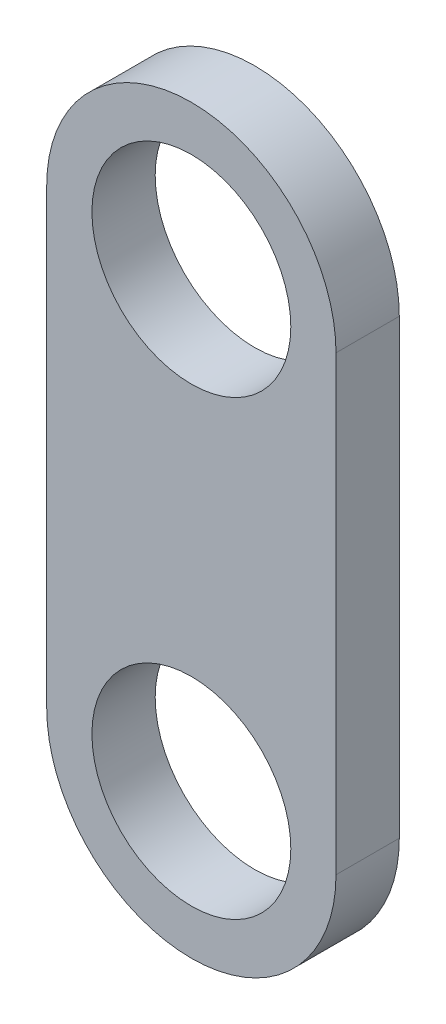
from build123d import *

# Parameters (mm, degrees)
SKETCH1_R           = 11
BOSS_EXTRUDE1_DEPTH = 7


with BuildPart() as part:
    # Sketch1 → Boss-Extrude1 (new body)
    with BuildSketch(Plane.XY):
        with BuildLine():
            ThreePointArc((16, 25), (0, 41), (-16, 25))
            Line((-16, 25), (-16, -25))
            ThreePointArc((-16, -25), (0, -41), (16, -25))
            Line((16, -25), (16, 25))
        make_face()
        with Locations((0, 25)):
            Circle(SKETCH1_R, mode=Mode.SUBTRACT)
        with Locations((0, -25)):
            Circle(SKETCH1_R, mode=Mode.SUBTRACT)
    extrude(amount=BOSS_EXTRUDE1_DEPTH)


solid = part.part
